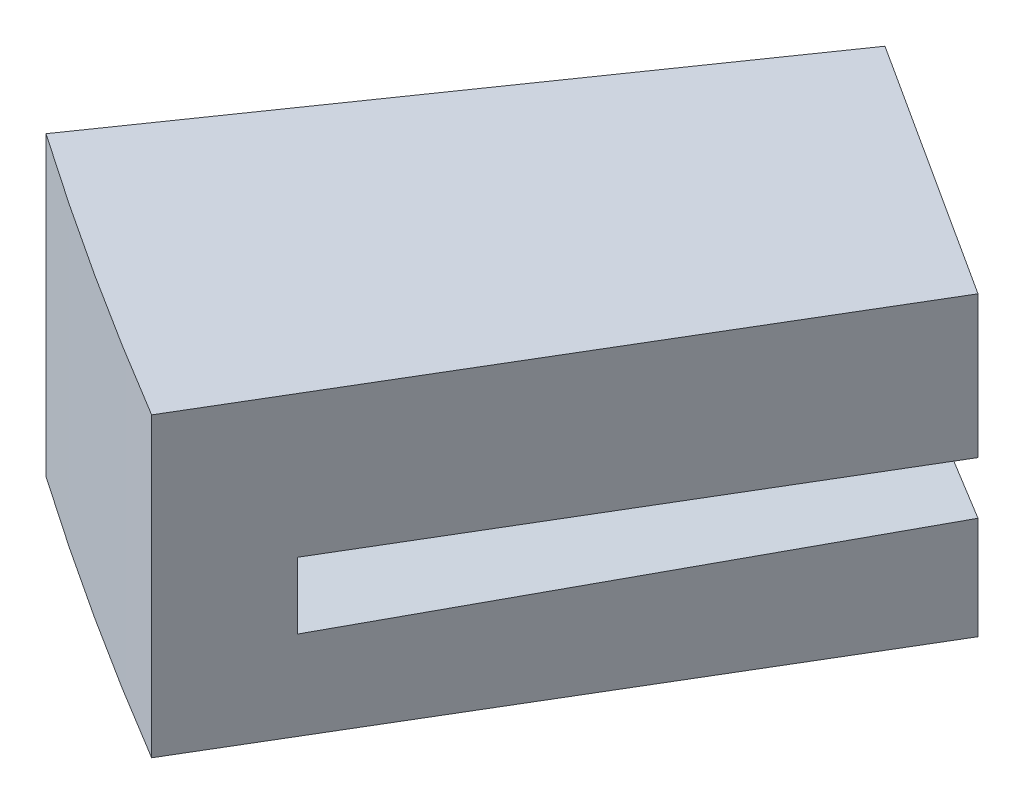
from build123d import *

# Parameters (mm, degrees)
BOSS_EXTRUDE1_DEPTH = 4.7625
BOSS_EXTRUDE2_DEPTH = 10.16
BOSS_EXTRUDE3_START = 6.35
BOSS_EXTRUDE3_DEPTH = 6.35
REVOLVE1_ANGLE      = 4


with BuildPart() as part:
    # Sketch1 → Boss-Extrude1 (new body)
    with BuildSketch(Plane(origin=(0, 0, 0), x_dir=(1, 0, 0), z_dir=(0, 1, 0))):
        with BuildLine():
            Line((-201.832488243, -290.825801155), (-206.177018076, -297.085949758))
            ThreePointArc((-206.177018076, -297.085949758), (-195.683270483, -304.100447187), (-184.951112968, -310.744445064))
            Line((-184.951112968, -310.744445064), (-181.053852083, -304.196486787))
            ThreePointArc((-181.053852083, -304.196486787), (-191.559863256, -297.692490193), (-201.832488243, -290.825801155))
        make_face()
    extrude(amount=BOSS_EXTRUDE1_DEPTH)

    # Sketch2 → Boss-Extrude2 (add)
    with BuildSketch(Plane(origin=(0, 4.7625, 0), x_dir=(1, 0, 0), z_dir=(0, 1, 0))):
        with BuildLine():
            Line((-206.177018076, -297.085949758), (-181.558015689, -261.611774341))
            Line((-181.558015689, -261.611774341), (-162.86663462, -273.639348162))
            Line((-162.86663462, -273.639348162), (-184.951112968, -310.744445064))
            ThreePointArc((-184.951112968, -310.744445064), (-195.683270483, -304.100447187), (-206.177018076, -297.085949758))
        make_face()
    extrude(amount=BOSS_EXTRUDE2_DEPTH)

    # Sketch3 → Boss-Extrude3 (add)
    with BuildSketch(Plane.XZ.offset(BOSS_EXTRUDE3_START)):
        with BuildLine():
            ThreePointArc((-184.951112968, 310.744445064), (-195.683270483, 304.100447187), (-206.177018076, 297.085949758))
            Line((-206.177018076, 297.085949758), (-201.832488243, 290.825801155))
            ThreePointArc((-201.832488243, 290.825801155), (-191.559863256, 297.692490193), (-181.053852083, 304.196486787))
            Line((-181.053852083, 304.196486787), (-184.951112968, 310.744445064))
        make_face()
        with BuildLine():
            Line((-162.86663462, 273.639348162), (-181.053852083, 304.196486787))
            ThreePointArc((-181.053852083, 304.196486787), (-191.559863256, 297.692490193), (-201.832488243, 290.825801155))
            Line((-201.832488243, 290.825801155), (-181.558015689, 261.611774341))
            Line((-181.558015689, 261.611774341), (-162.86663462, 273.639348162))
        make_face()
    extrude(amount=-BOSS_EXTRUDE3_DEPTH)

    # Sketch4 → Revolve1 (revolve)
    with BuildSketch(Plane(origin=(0, 0, 0), x_dir=(-0.5701482720363652, 0, 0.8215418114094662), z_dir=(-0.8215418114094664, 0, -0.5701482720363652))):
        Polygon((318.439999898, 1), (353.999999898, 0), (318.439999898, 0), align=None)
    revolve(axis=Axis((0, 0, 0), (0, 1, 0)), revolution_arc=REVOLVE1_ANGLE)


solid = part.part
